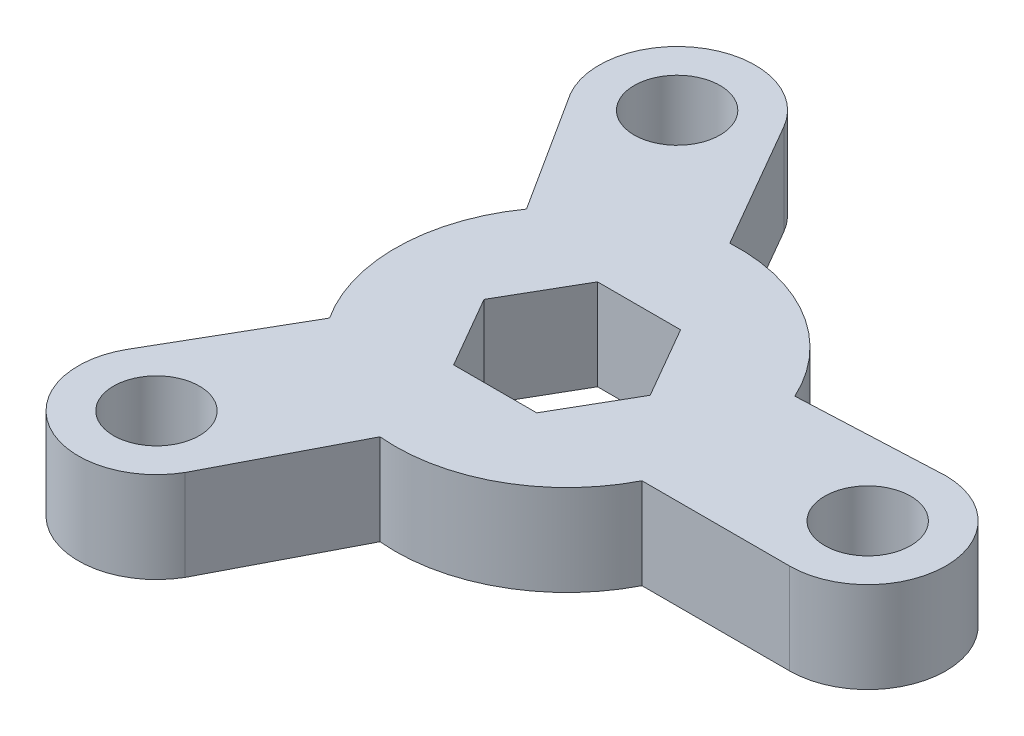
from build123d import *

# Parameters (mm, degrees)
SKETCH1_R           = 1.5
BOSS_EXTRUDE1_DEPTH = 3.175


with BuildPart() as part:
    # Sketch1 → Boss-Extrude1 (new body)
    with BuildSketch(Plane(origin=(0, 0, 0), x_dir=(1, 0, 0), z_dir=(0, 1, 0))):
        with BuildLine():
            Line((7.858300919, -2.484134681), (13.014762042, -2.484134681))
            ThreePointArc((13.014762042, -2.484134681), (15.743606535, 0.244709812), (13.014762042, 2.973554305))
            Line((13.014762042, 2.973554305), (7.969118099, 2.744709812))
            ThreePointArc((7.969118099, 2.744709812), (5.624188125, 5.376129638), (2.206241257, 6.236772472))
            Line((2.206241257, 6.236772472), (-0.371989304, 10.702398798))
            ThreePointArc((-0.371989304, 10.702398798), (-4.099660205, 11.701225206), (-5.098486612, 7.973554305))
            Line((-5.098486612, 7.973554305), (-2.377479496, 3.718320719))
            ThreePointArc((-2.377479496, 3.718320719), (-3.483890927, 0.371841879), (-2.520256051, -3.018508355))
            Line((-2.520256051, -3.018508355), (-5.098486612, -7.484134681))
            ThreePointArc((-5.098486612, -7.484134681), (-4.099660205, -11.211805582), (-0.371989304, -10.212979174))
            Line((-0.371989304, -10.212979174), (1.952647522, -5.728901095))
            ThreePointArc((1.952647522, -5.728901095), (5.403988927, -5.013842081), (7.858300919, -2.484134681))
        make_face()
        Polygon((3.965354593, 2.757209812), (5.415947144, 0.244709812), (3.965354593, -2.267790188), (1.06416949, -2.267790188), (-0.386423061, 0.244709812), (1.06416949, 2.757209812), align=None, mode=Mode.SUBTRACT)
        with Locations(Location((13.014762042, 0.244709812, 0), (0, 0, 270))):
            Circle(SKETCH1_R, mode=Mode.SUBTRACT)
        with Locations(Location((-2.735237958, 9.337976552, 0), (0, 0, 270))):
            Circle(SKETCH1_R, mode=Mode.SUBTRACT)
        with Locations(Location((-2.735237958, -8.848556928, 0), (0, 0, 270))):
            Circle(SKETCH1_R, mode=Mode.SUBTRACT)
    extrude(amount=BOSS_EXTRUDE1_DEPTH)


solid = part.part
